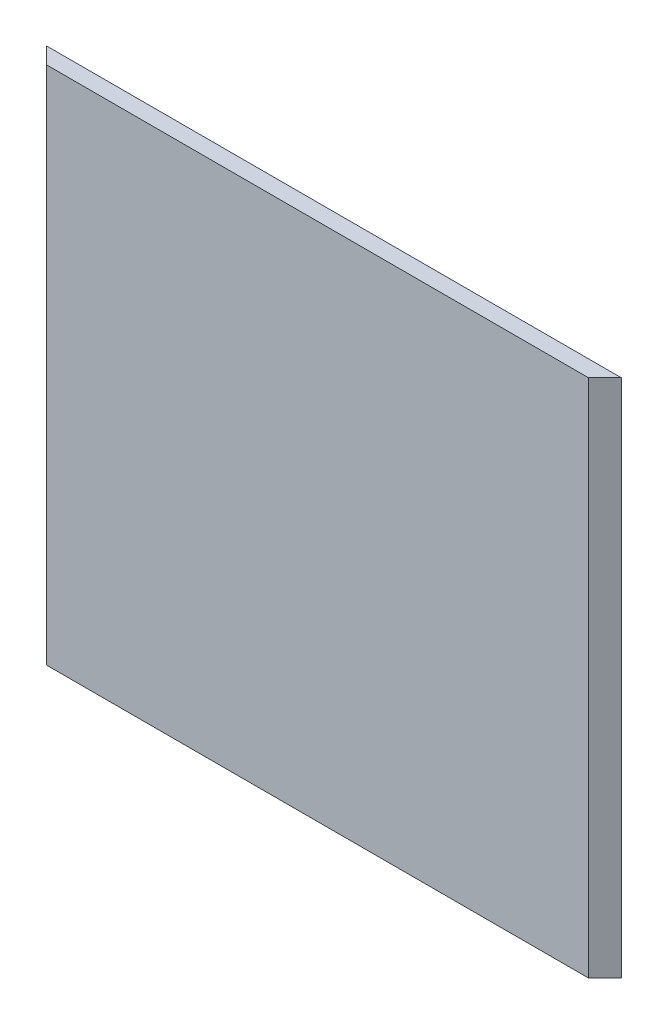
from build123d import *

# Parameters (mm, degrees)
BOSS_EXTRUDE1_DEPTH = 95


with BuildPart() as part:
    # Sketch1 → Boss-Extrude1 (new body)
    with BuildSketch(Plane(origin=(0, 0, 0), x_dir=(1, 0, 0), z_dir=(0, 1, 0))):
        Polygon((52.5, 1.5), (-52.5, 1.5), (-49.5, -1.5), (49.5, -1.5), align=None)
    extrude(amount=BOSS_EXTRUDE1_DEPTH)


solid = part.part
